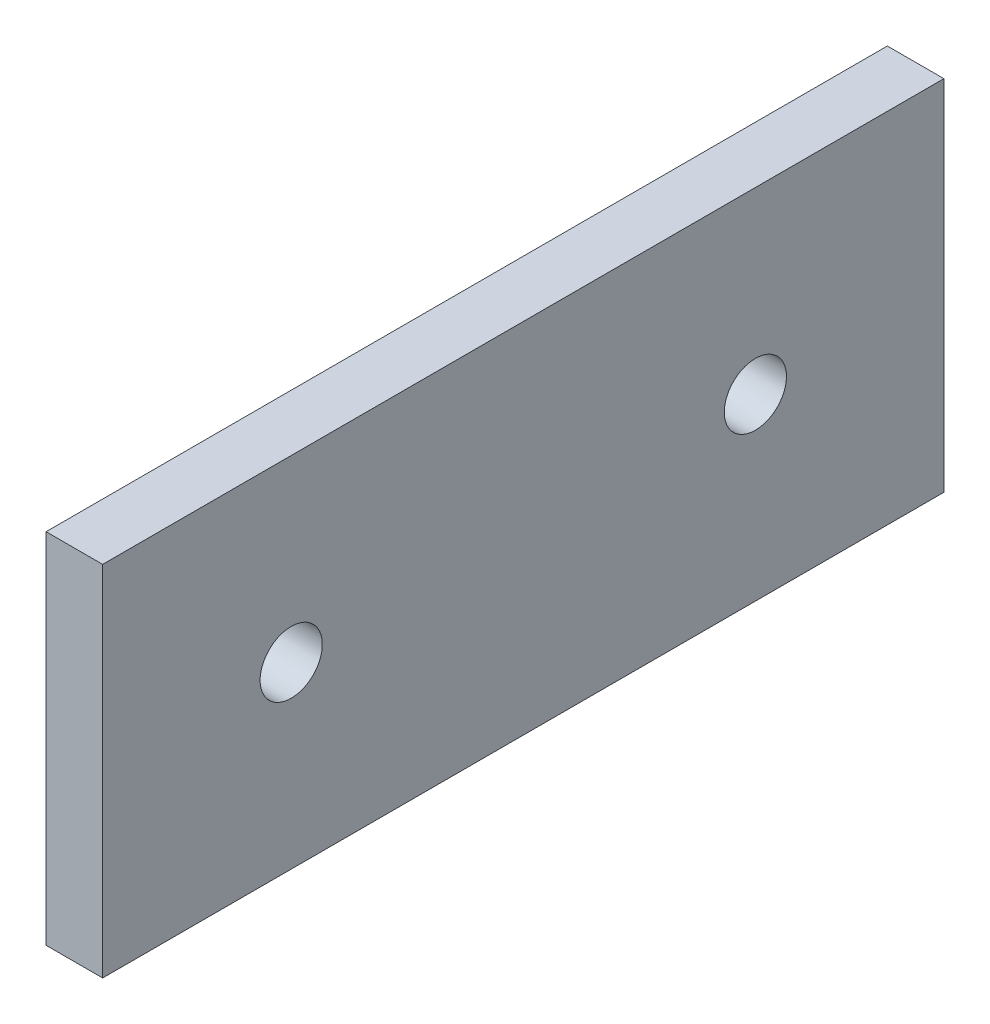
from build123d import *

# Parameters (mm, degrees)
SKETCH_1_W          = 19
SKETCH_1_H          = 19
SKETCH_1_W_2        = 13
SKETCH_1_H_2        = 13
EXTRUDE_1_DEPTH     = 44.62
SKETCH_2_R          = 1.65
CUT_EXTRUDE_1_DEPTH = 30
SKETCH_3_W          = 44.62
SKETCH_3_H          = 19
CUT_EXTRUDE_2_DEPTH = 16


with BuildPart() as part:
    # 草图1 → Extrude 1 (new body)
    with BuildSketch(Plane.XY):
        with Locations((6.5, 6.5)):
            Rectangle(SKETCH_1_W, SKETCH_1_H)
        with Locations((6.5, 6.5)):
            Rectangle(SKETCH_1_W_2, SKETCH_1_H_2, mode=Mode.SUBTRACT)
    extrude(amount=EXTRUDE_1_DEPTH)

    # 草图2 → 切除-拉伸1 (cut)
    with BuildSketch(Plane.ZY.offset(3)):
        with Locations((10, 6.5)):
            Circle(SKETCH_2_R)
        with Locations((34.62, 6.5)):
            Circle(SKETCH_2_R)
    extrude(amount=-CUT_EXTRUDE_1_DEPTH, mode=Mode.SUBTRACT)

    # 草图3 → 切除-拉伸2 (cut)
    with BuildSketch(Plane(origin=(16, 0, 0), x_dir=(0, 0, -1), z_dir=(1, 0, 0))):
        with Locations((-22.31, 6.5)):
            Rectangle(SKETCH_3_W, SKETCH_3_H)
    extrude(amount=-CUT_EXTRUDE_2_DEPTH, mode=Mode.SUBTRACT)


solid = part.part
